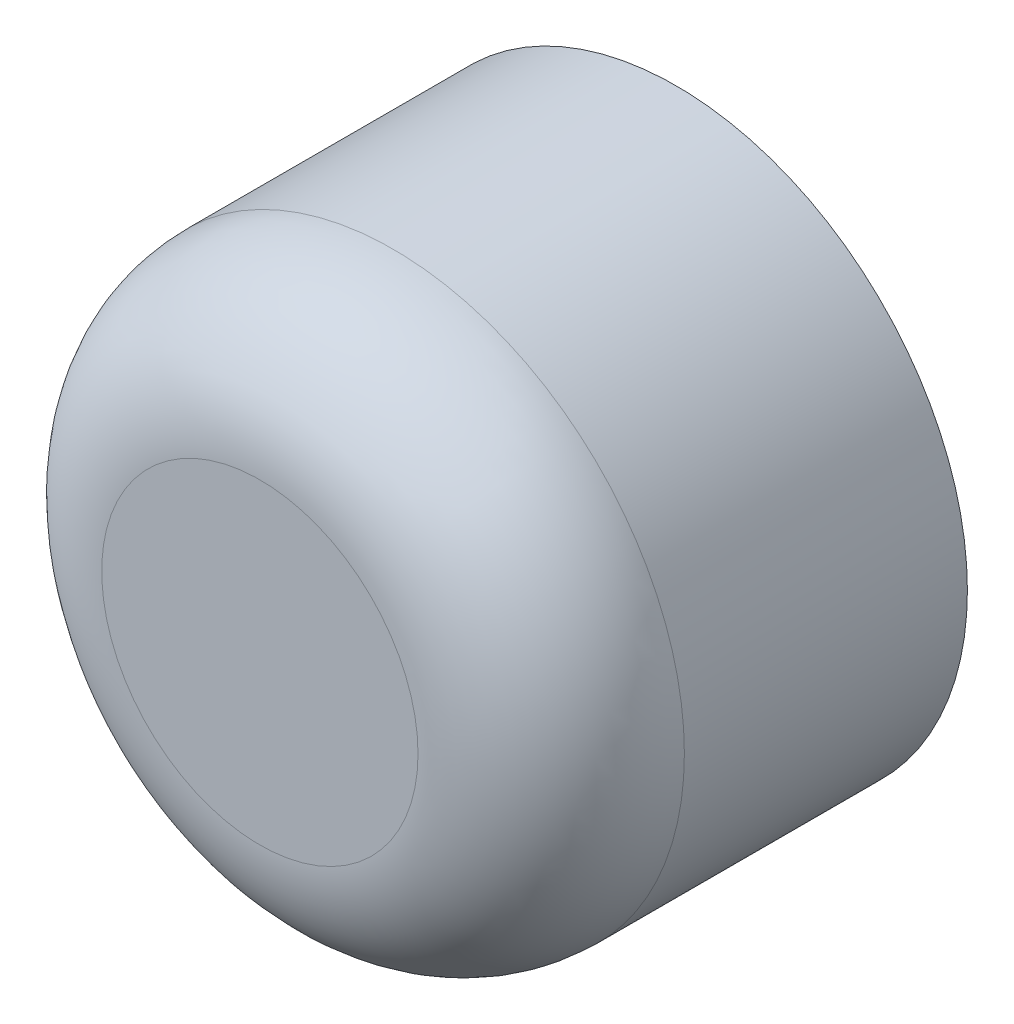
from build123d import *

# Parameters (mm, degrees)
SKETCH2_R           = 17.5
SKETCH2_R_2         = 12.5
BOSS_EXTRUDE1_DEPTH = 20
SKETCH3_R           = 17.5
BOSS_EXTRUDE2_DEPTH = 5
FILLET2_R           = 8


with BuildPart() as part:
    # Sketch2 → Boss-Extrude1 (new body)
    with BuildSketch(Plane.XY):
        Circle(SKETCH2_R)
        Circle(SKETCH2_R_2, mode=Mode.SUBTRACT)
    extrude(amount=BOSS_EXTRUDE1_DEPTH)

    # Sketch3 → Boss-Extrude2 (add)
    with BuildSketch(Plane.XY.offset(20)):
        Circle(SKETCH3_R)
    extrude(amount=BOSS_EXTRUDE2_DEPTH)

    # Fillet2
    fillet2_edges = [part.edges().sort_by_distance(p)[0] for p in [
        (-17.5, 0, 25),
    ]]
    fillet(fillet2_edges, radius=FILLET2_R)


solid = part.part
